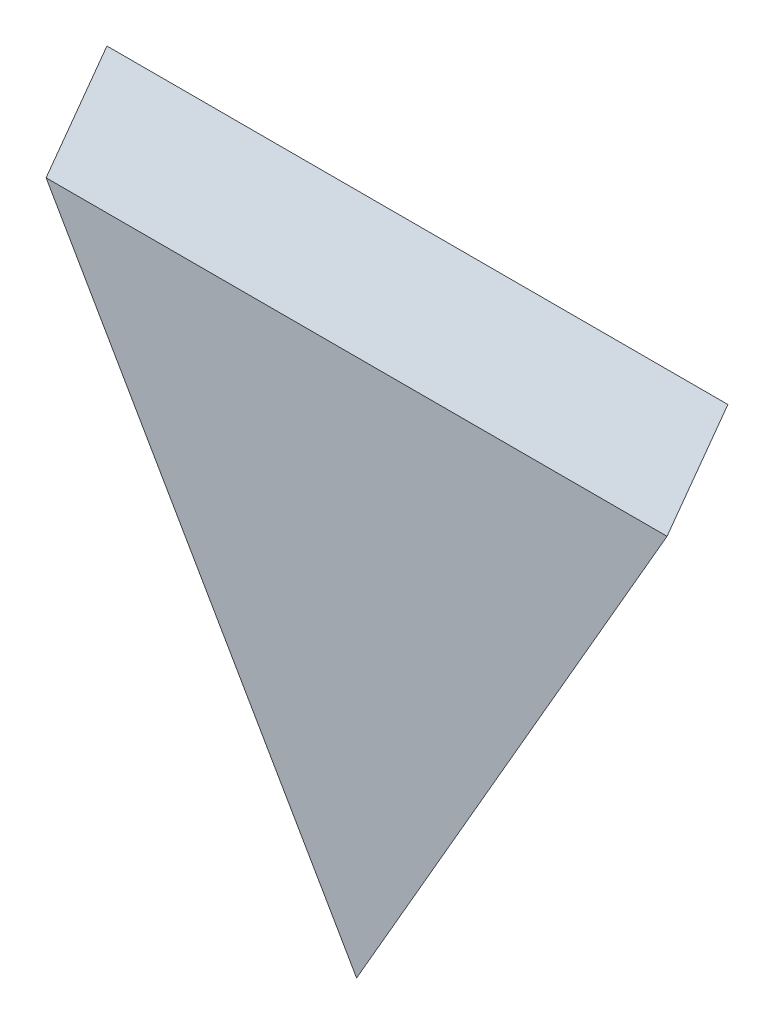
from build123d import *


with BuildPart() as part:
    # Sweep4: sweep along a path in Sketch2
    with BuildLine(Plane(origin=(0, 0, 0), x_dir=(0, 0, -1), z_dir=(1, 0, 0))) as sweep4_path:
        Line((0, 57.570572628), (7.464872704, 67.845088456))
    # Sketch1 → Sweep4 (sweep)
    with BuildSketch(Plane.XY):
        Polygon((0, 0), (38.1, 65.991135768), (-38.1, 65.991135768), align=None)
    sweep(path=sweep4_path.line)


solid = part.part
